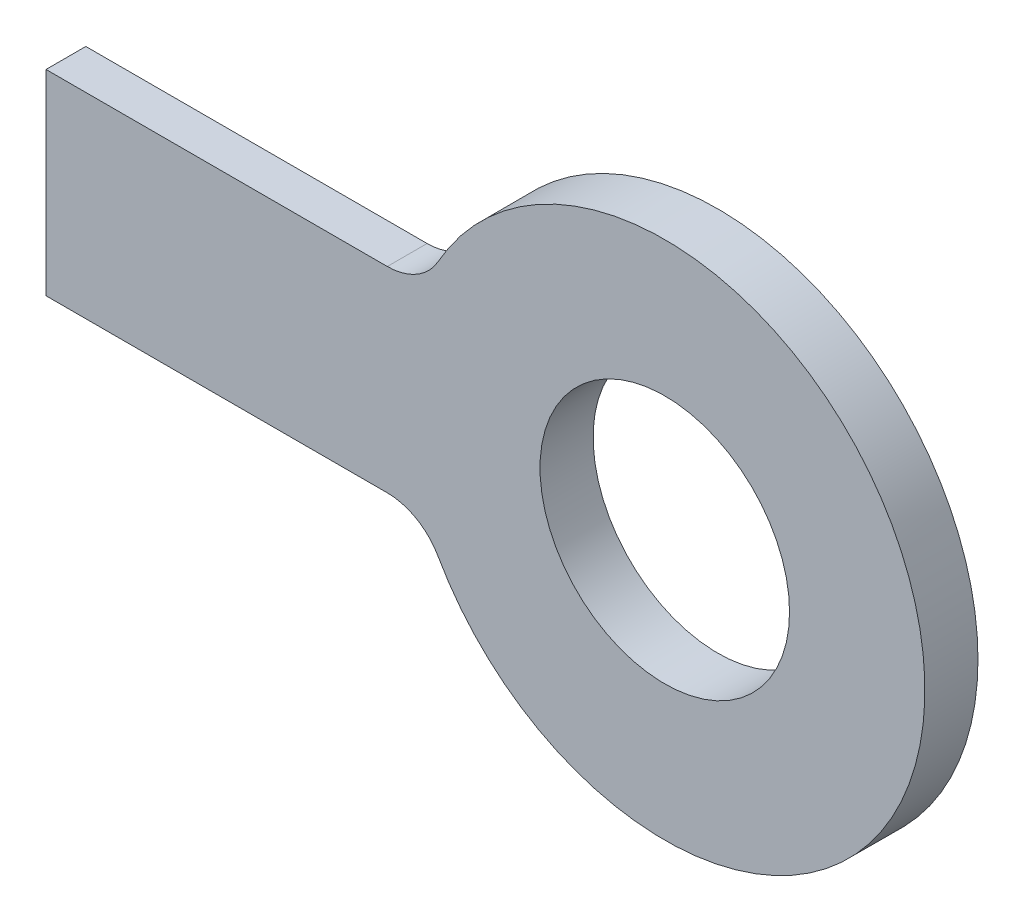
from build123d import *

# Parameters (mm, degrees)
SKETCH_1_R      = 98
SKETCH_1_R_2    = 47
EXTRUDE_1_DEPTH = 20
SKETCH_2_W      = 142.329371157
SKETCH_2_H      = 73.846071027
EXTRUDE_2_DEPTH = 15
FILLET_1_R      = 22


with BuildPart() as part:
    # 草图1 → 凸台-拉伸1 (new body)
    with BuildSketch(Plane.XY):
        with Locations((-11.887359686, -2.794806673)):
            Circle(SKETCH_1_R)
        with Locations((-11.887359686, -2.794806673)):
            Circle(SKETCH_1_R_2, mode=Mode.SUBTRACT)
    extrude(amount=EXTRUDE_1_DEPTH)

    # 草图2 → 凸台-拉伸2 (add)
    with BuildSketch(Plane.XY.offset(20)):
        with Locations((-173.83028852, -2.794806673)):
            Rectangle(SKETCH_2_W, SKETCH_2_H)
    extrude(amount=-EXTRUDE_2_DEPTH)

    # 圆角1
    fillet_1_edges = [part.edges().sort_by_distance(p)[0] for p in [
        (-102.665602941, 34.128228841, 12.5),
        (-102.665602941, -39.717842186, 12.5),
    ]]
    fillet(fillet_1_edges, radius=FILLET_1_R)


solid = part.part
